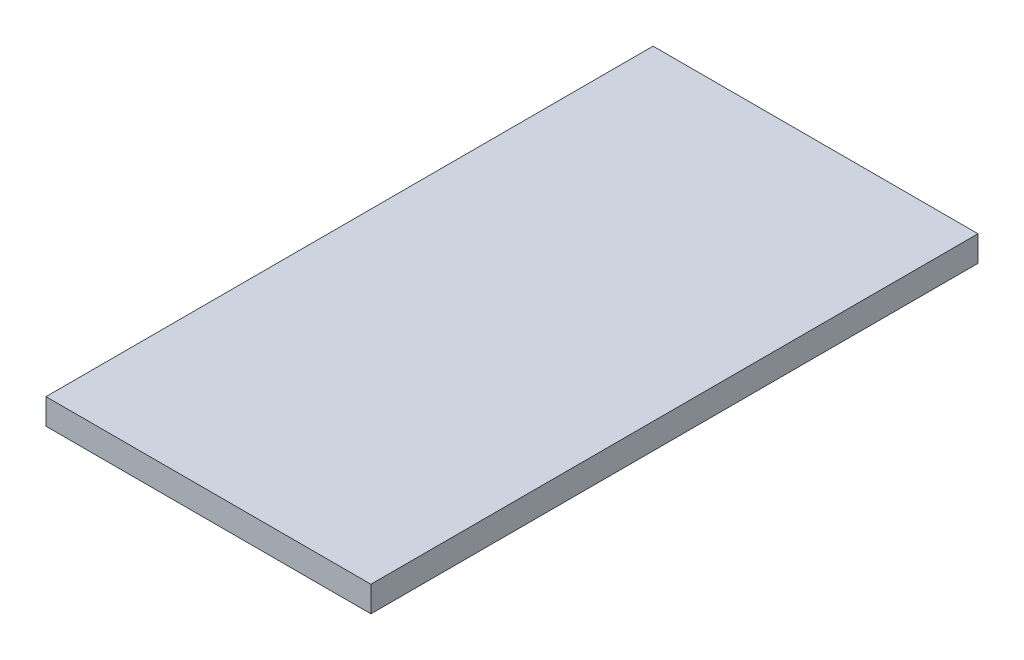
from build123d import *

# Parameters (mm, degrees)
CROQUIS1_W              = 380
CROQUIS1_H              = 710
SALIENTE_EXTRUIR1_DEPTH = 30


with BuildPart() as part:
    # Croquis1 → Saliente-Extruir1 (new body)
    with BuildSketch(Plane(origin=(0, 0, 0), x_dir=(1, 0, 0), z_dir=(0, 1, 0))):
        with Locations((190, 355)):
            Rectangle(CROQUIS1_W, CROQUIS1_H)
    extrude(amount=SALIENTE_EXTRUIR1_DEPTH)


solid = part.part
